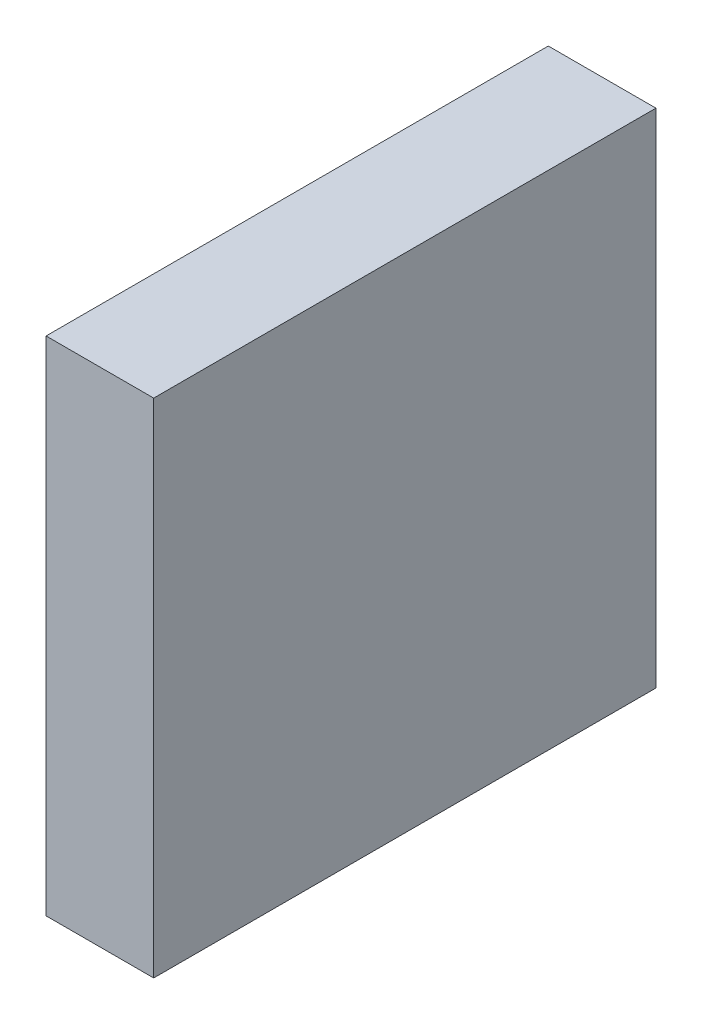
from build123d import *

# Parameters (mm, degrees)
TOPPING_EVAP_FAN_2_1_START = -330
SKETCH1_W                  = 30
SKETCH1_H                  = 140
TOPPING_EVAP_FAN_2_1_DEPTH = 140


with BuildPart() as part:
    # Sketch1 → TOPPING_evap_fan_2_1 (new body)
    with BuildSketch(Plane.XY.offset(TOPPING_EVAP_FAN_2_1_START)):
        with Locations((187.5, 1250)):
            Rectangle(SKETCH1_W, SKETCH1_H)
    extrude(amount=-TOPPING_EVAP_FAN_2_1_DEPTH)


solid = part.part
